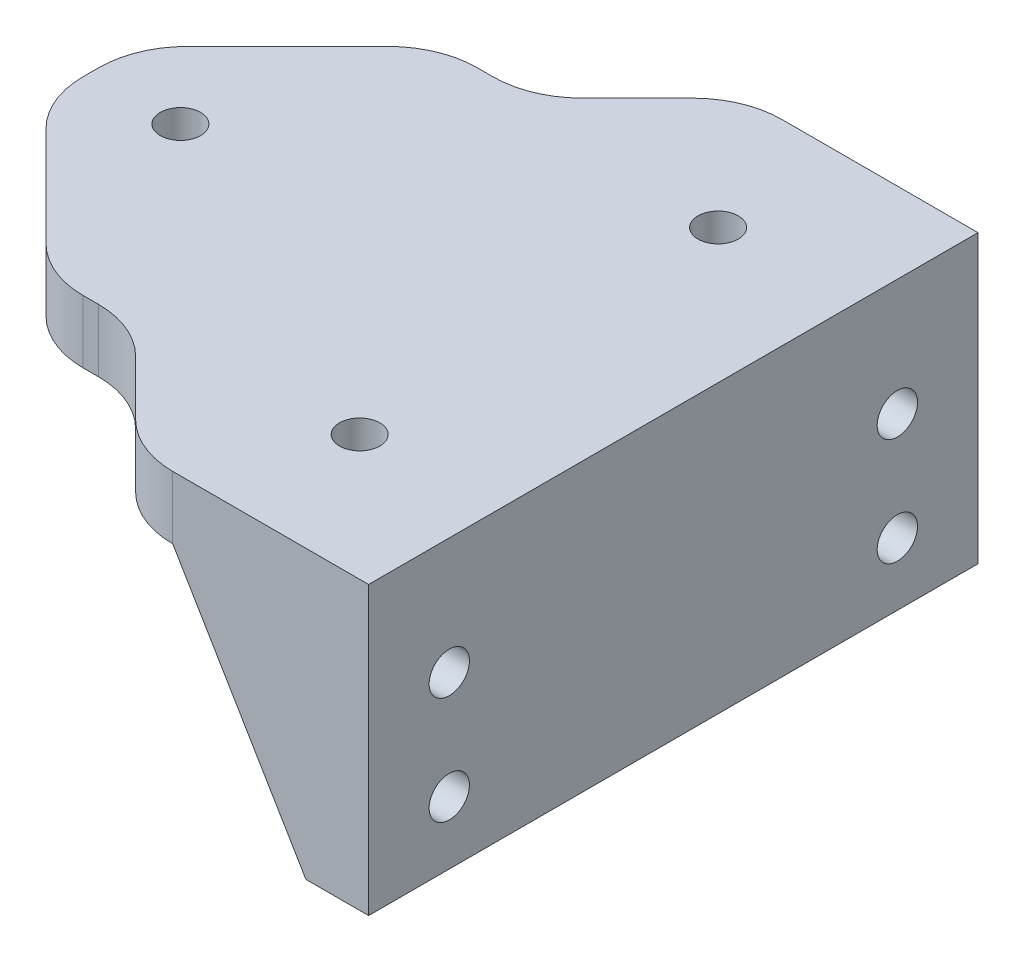
from build123d import *

# Parameters (mm, degrees)
SKETCH1_W            = 60
SKETCH1_H            = 68
BOSS_EXTRUDE1_DEPTH  = 7
M4_CLEARANCE_HOLE4_D = 4.5
CUT_EXTRUDE5_DEPTH   = 91.956033335
FILLET3_R            = 10
SKETCH30_W           = 68
SKETCH30_H           = 7
BOSS_EXTRUDE8_DEPTH  = 5
SKETCH31_W           = 7
SKETCH31_H           = 68
BOSS_EXTRUDE9_DEPTH  = 25
M4_CLEARANCE_HOLE5_D = 4.5
BOSS_EXTRUDE12_DEPTH = 3
BOSS_EXTRUDE13_DEPTH = 3


with BuildPart() as part:
    # Sketch1 → Boss-Extrude1 (new body)
    with BuildSketch(Plane(origin=(0, 0, 0), x_dir=(1, 0, 0), z_dir=(0, 1, 0))):
        with Locations((30, 34)):
            Rectangle(SKETCH1_W, SKETCH1_H)
    extrude(amount=BOSS_EXTRUDE1_DEPTH)

    # M4 Clearance Hole4 (through all)
    with Locations(Plane(origin=(0, 0, 0), x_dir=(-1, 0, 0), z_dir=(0, -1, 0))):
        with Locations((-50, 54), (-50, 14), (-10, 34)):
            Hole(M4_CLEARANCE_HOLE4_D / 2)

    # Sketch29 → Cut-Extrude5 (cut, through all)
    with BuildSketch(Plane.XZ):
        Polygon((39, 0), (27, -12), (17, -12), (0, -29), (0, 0), align=None)
        Polygon((0, -39), (0, -68), (39, -68), (27, -56), (17, -56), align=None)
    extrude(amount=-CUT_EXTRUDE5_DEPTH, mode=Mode.SUBTRACT)

    # Fillet3
    fillet3_edges = [part.edges().sort_by_distance(p)[0] for p in [
        (39, 3.5, 0),
        (27, 3.5, -12),
        (17, 3.5, -12),
        (0, 3.5, -29),
        (0, 3.5, -39),
        (17, 3.5, -56),
        (27, 3.5, -56),
        (39, 3.5, -68),
    ]]
    fillet(fillet3_edges, radius=FILLET3_R)

    # Sketch30 → Boss-Extrude8 (add)
    with BuildSketch(Plane(origin=(60, 0, 0), x_dir=(0, 0, -1), z_dir=(1, 0, 0))):
        with Locations((34, 3.5)):
            Rectangle(SKETCH30_W, SKETCH30_H)
    extrude(amount=BOSS_EXTRUDE8_DEPTH)

    # Sketch31 → Boss-Extrude9 (add)
    with BuildSketch(Plane.XZ):
        with Locations((61.5, -34)):
            Rectangle(SKETCH31_W, SKETCH31_H)
    extrude(amount=BOSS_EXTRUDE9_DEPTH)

    # M4 Clearance Hole5 (through all)
    with Locations(Plane(origin=(65, 0, 0), x_dir=(0, 0, -1), z_dir=(1, 0, 0))):
        with Locations((59, -6), (59, -18), (9, -6), (9, -18)):
            Hole(M4_CLEARANCE_HOLE5_D / 2)

    # Sketch36 → Boss-Extrude12 (add)
    with BuildSketch(Plane.XY):
        Polygon((58, -25), (43.142135624, 0), (58, 0), align=None)
    extrude(amount=-BOSS_EXTRUDE12_DEPTH)

    # Sketch37 → Boss-Extrude13 (add)
    with BuildSketch(Plane(origin=(0, 0, -68), x_dir=(-1, 0, 0), z_dir=(0, 0, -1))):
        Polygon((-43.142135624, 0), (-58, -25), (-58, 0), align=None)
    extrude(amount=-BOSS_EXTRUDE13_DEPTH)


solid = part.part
